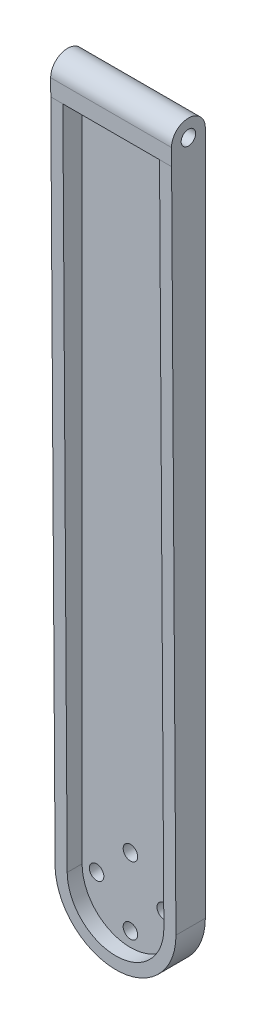
from build123d import *

# Parameters (mm, degrees)
SKETCH_1_R          = 1.5
EXTRUDE_1_DEPTH     = 3
EXTRUDE_3_DEPTH     = 25
SKETCH_4_R          = 1.5
EXTRUDE_5_DEPTH     = 25
CUT_EXTRUDE_1_DEPTH = 25


with BuildPart() as part:
    # 草图1 → 凸台-拉伸1 (new body)
    with BuildSketch(Plane.XY):
        with BuildLine():
            Line((-12.5, -62.82700984), (-12.5, 75.32700984))
            Line((-12.5, 75.32700984), (12.5, 75.32700984))
            Line((12.5, 75.32700984), (12.5, -62.82700984))
            ThreePointArc((12.5, -62.82700984), (0, -75.32700984), (-12.5, -62.82700984))
        make_face()
        with Locations((7, -62.82700984)):
            Circle(SKETCH_1_R, mode=Mode.SUBTRACT)
        with Locations((0, -69.82700984)):
            Circle(SKETCH_1_R, mode=Mode.SUBTRACT)
        with Locations((-7, -62.82700984)):
            Circle(SKETCH_1_R, mode=Mode.SUBTRACT)
        with Locations((0, -55.82700984)):
            Circle(SKETCH_1_R, mode=Mode.SUBTRACT)
    extrude(amount=EXTRUDE_1_DEPTH)

    # 草图3 → 凸台-拉伸3 (add)
    with BuildSketch(Plane.XY.offset(3)):
        with BuildLine():
            Line((10, -62.82700984), (10, 72.82700984))
            Line((10, 72.82700984), (10, 75.32700984))
            Line((10, 75.32700984), (12.5, 75.32700984))
            Line((12.5, 75.32700984), (12.5, -62.82700984))
            ThreePointArc((12.5, -62.82700984), (0, -75.32700984), (-12.5, -62.82700984))
            Line((-12.5, -62.82700984), (-12.5, 75.32700984))
            Line((-12.5, 75.32700984), (-10, 75.32700984))
            Line((-10, 75.32700984), (-10, 72.82700984))
            Line((-10, 72.82700984), (-10, -62.82700984))
            ThreePointArc((-10, -62.82700984), (0, -72.82700984), (10, -62.82700984))
        make_face()
    extrude(amount=EXTRUDE_3_DEPTH)

    # 草图4 → 凸台-拉伸5 (add)
    with BuildSketch(Plane(origin=(12.5, 0, 0), x_dir=(0, 0, -1), z_dir=(1, 0, 0))):
        with BuildLine():
            Line((-3, 75.32700984), (0, 75.32700984))
            Line((0, 75.32700984), (0, 78.791111455))
            ThreePointArc((0, 78.791111455), (-3.511355462, 82.291093034), (-6.999926316, 78.768400651))
            Line((-6.999926316, 78.768400651), (-6.977595346, 75.32700984))
            Line((-6.977595346, 75.32700984), (-3.5, 75.32700984))
            Line((-3.5, 75.32700984), (-3, 75.32700984))
        make_face()
        with Locations((-3.5, 78.791111455)):
            Circle(SKETCH_4_R, mode=Mode.SUBTRACT)
    extrude(amount=-EXTRUDE_5_DEPTH)

    # 草图5 → 切除-拉伸1 (cut)
    with BuildSketch(Plane(origin=(12.5, 0, 0), x_dir=(0, 0, -1), z_dir=(1, 0, 0))):
        Polygon((-6, -75.32700984), (-6.977595346, 75.32700984), (-30.364009186, 75.32700984), (-30.364009186, -75.32700984), align=None)
    extrude(amount=-CUT_EXTRUDE_1_DEPTH, mode=Mode.SUBTRACT)


solid = part.part
